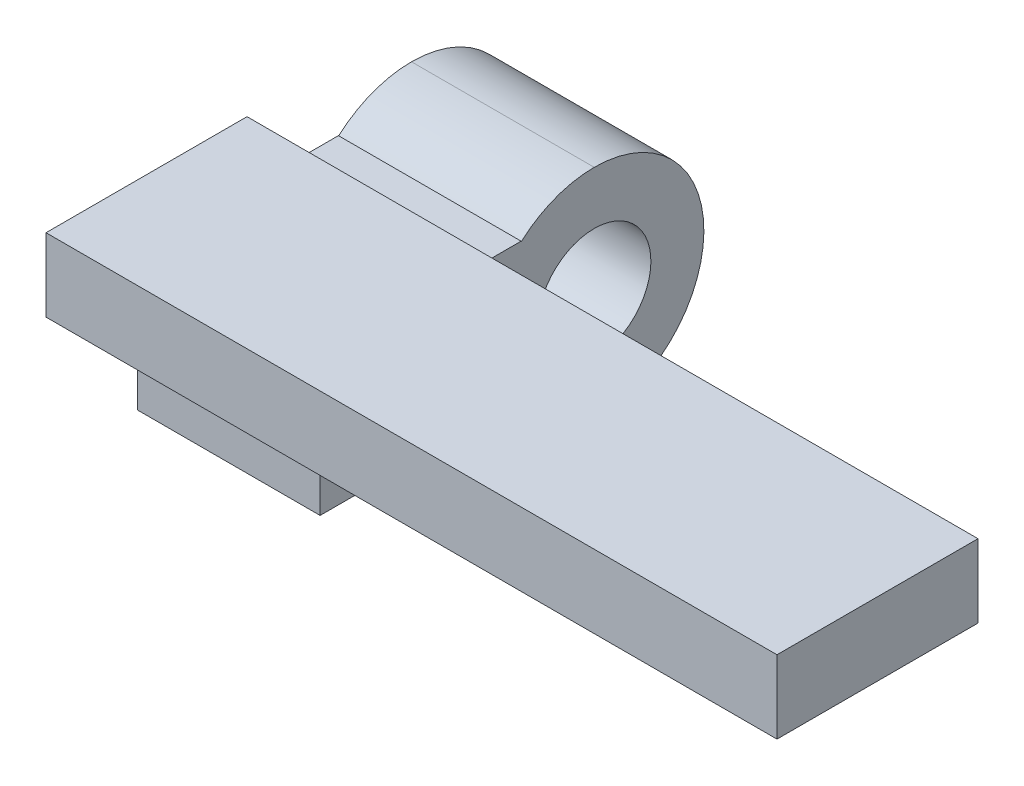
from build123d import *

# Parameters (mm, degrees)
SKETCH1_W           = 10
SKETCH1_H           = 2.9
REVOLVE1_ANGLE      = 359.999695921
BOSS_EXTRUDE1_START = -3
SKETCH2_W           = 10
SKETCH2_H           = 11
BOSS_EXTRUDE1_DEPTH = 7.5
BOSS_EXTRUDE2_START = 3.9
SKETCH3_W           = 40
SKETCH3_H           = 11
BOSS_EXTRUDE2_DEPTH = 4


with BuildPart() as part:
    # Sketch1 → Revolve1 (revolve)
    with BuildSketch(Plane.XY):
        with Locations((0, 4.55)):
            Rectangle(SKETCH1_W, SKETCH1_H)
    revolve(axis=Axis((-5, 0, 0), (1, 0, 0)), revolution_arc=REVOLVE1_ANGLE)

    # Sketch2 → Boss-Extrude1 (add)
    with BuildSketch(Plane(origin=(0, 0, 0), x_dir=(1, 0, 0), z_dir=(0, 1, 0)).offset(BOSS_EXTRUDE1_START)):
        with Locations((0, -9.5)):
            Rectangle(SKETCH2_W, SKETCH2_H)
    extrude(amount=BOSS_EXTRUDE1_DEPTH)

    # Sketch3 → Boss-Extrude2 (add)
    with BuildSketch(Plane(origin=(0, 0, 0), x_dir=(1, 0, 0), z_dir=(0, 1, 0)).offset(BOSS_EXTRUDE2_START)):
        with Locations((15, -14.5)):
            Rectangle(SKETCH3_W, SKETCH3_H)
    extrude(amount=BOSS_EXTRUDE2_DEPTH)


solid = part.part
